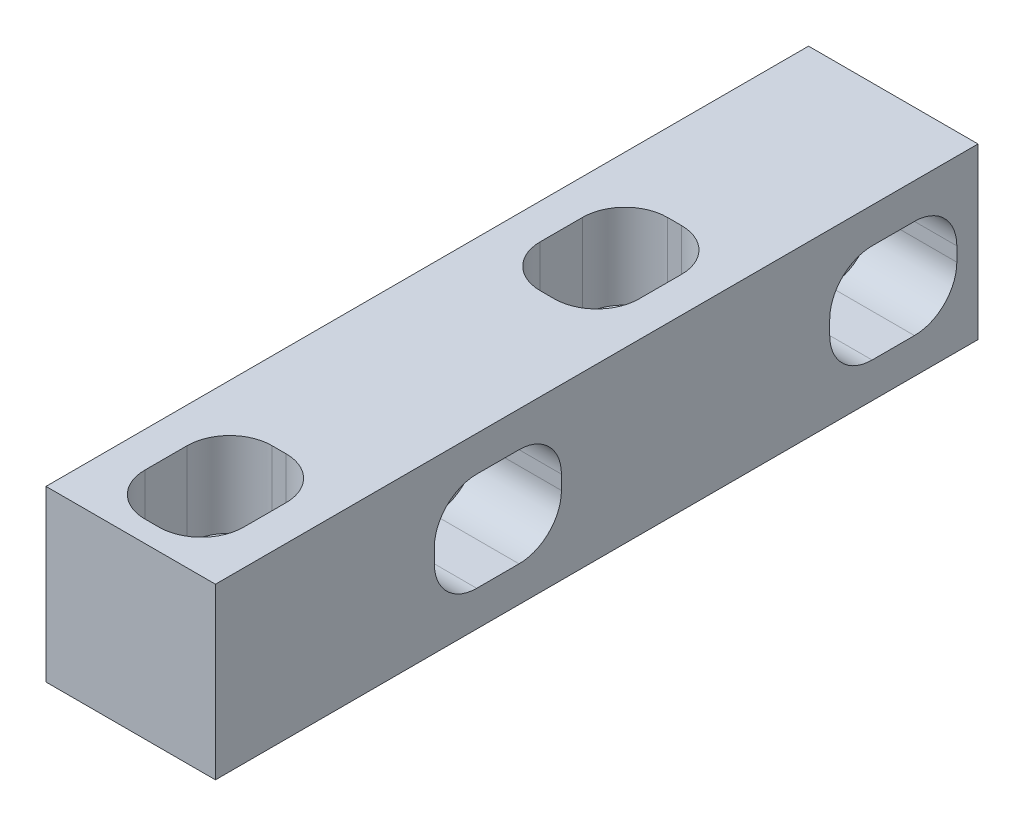
from build123d import *

# Parameters (mm, degrees)
SKETCH1_W           = 12
SKETCH1_H           = 12
BOSS_EXTRUDE1_DEPTH = 54
SKETCH2_R           = 2
CUT_EXTRUDE1_DEPTH  = 14
SKETCH3_R           = 2
CUT_EXTRUDE2_DEPTH  = 14
CUT_EXTRUDE3_DEPTH  = 6
CUT_EXTRUDE4_DEPTH  = 6


with BuildPart() as part:
    # Sketch1 → Boss-Extrude1 (new body)
    with BuildSketch(Plane.XY):
        Rectangle(SKETCH1_W, SKETCH1_H)
    extrude(amount=BOSS_EXTRUDE1_DEPTH)

    # Sketch2 → Cut-Extrude1 (cut)
    with BuildSketch(Plane(origin=(0, 6, 0), x_dir=(1, 0, 0), z_dir=(0, 1, 0))):
        with Locations(Location((0, -20, 0), (0, 0, 180))):
            Circle(SKETCH2_R)
        with Locations(Location((0, -48, 0), (0, 0, 180))):
            Circle(SKETCH2_R)
    extrude(amount=-CUT_EXTRUDE1_DEPTH, mode=Mode.SUBTRACT)

    # Sketch3 → Cut-Extrude2 (cut)
    with BuildSketch(Plane.ZY.offset(6)):
        with Locations(Location((34, 0, 0), (0, 0, 270))):
            Circle(SKETCH3_R)
        with Locations(Location((6, 0, 0), (0, 0, 270))):
            Circle(SKETCH3_R)
    extrude(amount=-CUT_EXTRUDE2_DEPTH, mode=Mode.SUBTRACT)

    # Sketch4 → Cut-Extrude3 (cut)
    with BuildSketch(Plane(origin=(6, 0, 0), x_dir=(0, 0, -1), z_dir=(1, 0, 0))):
        with BuildLine():
            Line((-4.5, -3.5), (-7.5, -3.5))
            ThreePointArc((-7.5, -3.5), (-9.621320344, -2.621320344), (-10.5, -0.5))
            Line((-10.5, -0.5), (-10.5, 0.5))
            ThreePointArc((-10.5, 0.5), (-9.621320344, 2.621320344), (-7.5, 3.5))
            Line((-7.5, 3.5), (-4.5, 3.5))
            ThreePointArc((-4.5, 3.5), (-2.378679656, 2.621320344), (-1.5, 0.5))
            Line((-1.5, 0.5), (-1.5, -0.5))
            ThreePointArc((-1.5, -0.5), (-2.378679656, -2.621320344), (-4.5, -3.5))
        make_face()
        with BuildLine():
            Line((-38.5, -0.5), (-38.5, 0.5))
            ThreePointArc((-38.5, 0.5), (-37.621320344, 2.621320344), (-35.5, 3.5))
            Line((-35.5, 3.5), (-32.5, 3.5))
            ThreePointArc((-32.5, 3.5), (-30.378679656, 2.621320344), (-29.5, 0.5))
            Line((-29.5, 0.5), (-29.5, -0.5))
            ThreePointArc((-29.5, -0.5), (-30.378679656, -2.621320344), (-32.5, -3.5))
            Line((-32.5, -3.5), (-35.5, -3.5))
            ThreePointArc((-35.5, -3.5), (-37.621320344, -2.621320344), (-38.5, -0.5))
        make_face()
    extrude(amount=-CUT_EXTRUDE3_DEPTH, mode=Mode.SUBTRACT)

    # Sketch5 → Cut-Extrude4 (cut)
    with BuildSketch(Plane(origin=(0, 6, 0), x_dir=(1, 0, 0), z_dir=(0, 1, 0))):
        with BuildLine():
            Line((-0.5, -52.5), (0.5, -52.5))
            ThreePointArc((0.5, -52.5), (2.621320344, -51.621320344), (3.5, -49.5))
            Line((3.5, -49.5), (3.5, -46.5))
            ThreePointArc((3.5, -46.5), (2.621320344, -44.378679656), (0.5, -43.5))
            Line((0.5, -43.5), (-0.5, -43.5))
            ThreePointArc((-0.5, -43.5), (-2.621320344, -44.378679656), (-3.5, -46.5))
            Line((-3.5, -46.5), (-3.5, -49.5))
            ThreePointArc((-3.5, -49.5), (-2.621320344, -51.621320344), (-0.5, -52.5))
        make_face()
        with BuildLine():
            Line((-0.5, -24.5), (0.5, -24.5))
            ThreePointArc((0.5, -24.5), (2.621320344, -23.621320344), (3.5, -21.5))
            Line((3.5, -21.5), (3.5, -18.5))
            ThreePointArc((3.5, -18.5), (2.621320344, -16.378679656), (0.5, -15.5))
            Line((0.5, -15.5), (-0.5, -15.5))
            ThreePointArc((-0.5, -15.5), (-2.621320344, -16.378679656), (-3.5, -18.5))
            Line((-3.5, -18.5), (-3.5, -21.5))
            ThreePointArc((-3.5, -21.5), (-2.621320344, -23.621320344), (-0.5, -24.5))
        make_face()
    extrude(amount=-CUT_EXTRUDE4_DEPTH, mode=Mode.SUBTRACT)


solid = part.part
